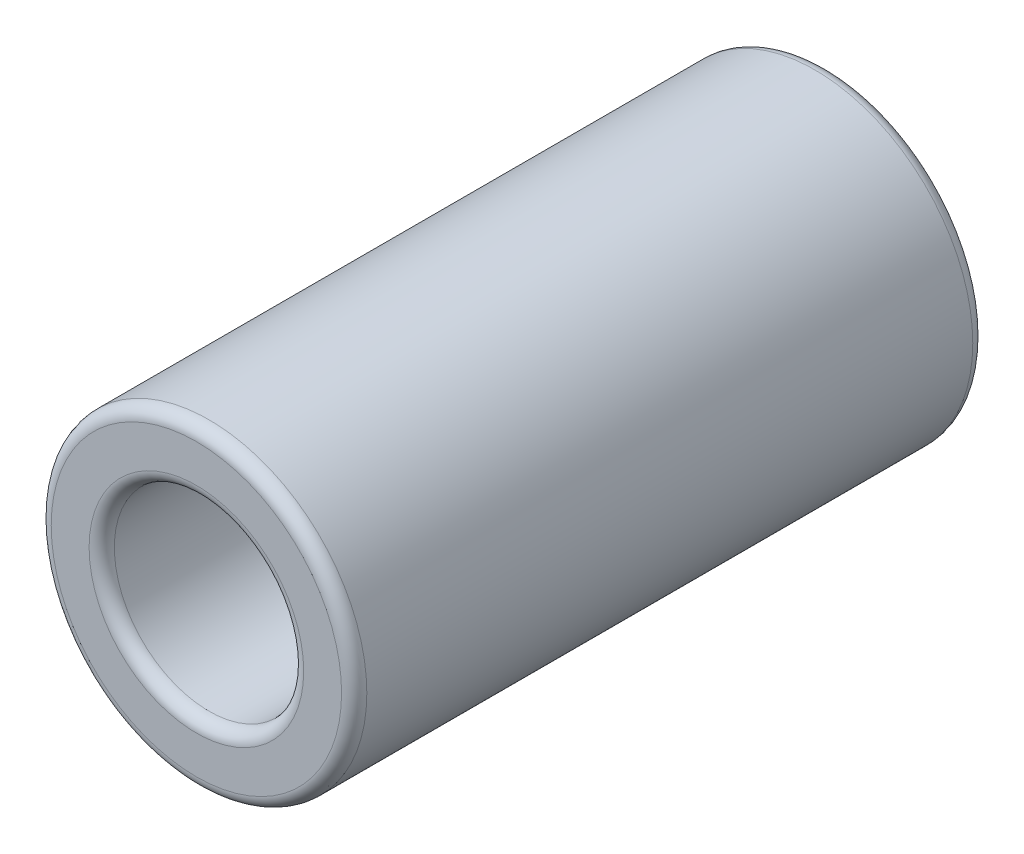
from build123d import *

# Parameters (mm, degrees)
SKETCH1_R           = 2.5
SKETCH1_R_2         = 1.5
BOSS_EXTRUDE1_DEPTH = 10
FILLET1_R           = 0.2


with BuildPart() as part:
    # Sketch1 → Boss-Extrude1 (new body)
    with BuildSketch(Plane.XY):
        Circle(SKETCH1_R)
        Circle(SKETCH1_R_2, mode=Mode.SUBTRACT)
    extrude(amount=BOSS_EXTRUDE1_DEPTH)

    # Fillet1
    fillet1_edges = [part.edges().sort_by_distance(p)[0] for p in [
        (-2.5, 0, 0),
        (-1.5, 0, 0),
        (-1.5, 0, 10),
        (-2.5, 0, 10),
    ]]
    fillet(fillet1_edges, radius=FILLET1_R)


solid = part.part
